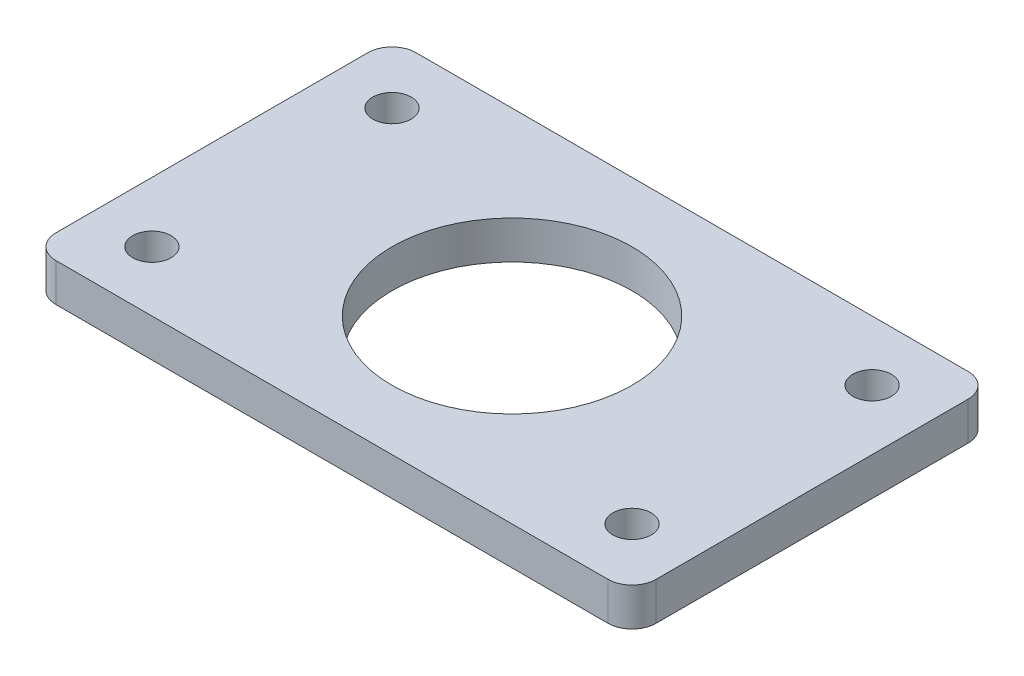
from build123d import *

# Parameters (mm, degrees)
SKETCH1_W                = 50
SKETCH1_H                = 30
SKETCH1_R                = 10
BOSS_EXTRUDE1_DEPTH      = 3.175
M3_CLEARANCE_HOLE1_D     = 3.2
M3_CLEARANCE_HOLE1_DEPTH = 3.175
FILLET1_R                = 2


with BuildPart() as part:
    # Sketch1 → Boss-Extrude1 (new body)
    with BuildSketch(Plane(origin=(0, 0, 0), x_dir=(1, 0, 0), z_dir=(0, 1, 0))):
        Rectangle(SKETCH1_W, SKETCH1_H)
        with Locations(Location((0, 0, 0), (0, 0, 270))):
            Circle(SKETCH1_R, mode=Mode.SUBTRACT)
    extrude(amount=BOSS_EXTRUDE1_DEPTH)

    # M3 Clearance Hole1
    with Locations(Plane(origin=(0, 3.175, 0), x_dir=(1, 0, 0), z_dir=(0, 1, 0))):
        with Locations((0, 0), (-20, 10), (20, -10), (20, 10), (-20, -10)):
            Hole(M3_CLEARANCE_HOLE1_D / 2, depth=M3_CLEARANCE_HOLE1_DEPTH)

    # Fillet1
    fillet1_edges = [part.edges().sort_by_distance(p)[0] for p in [
        (-25, 1.5875, -15),
        (25, 1.5875, -15),
        (25, 1.5875, 15),
        (-25, 1.5875, 15),
    ]]
    fillet(fillet1_edges, radius=FILLET1_R)


solid = part.part
